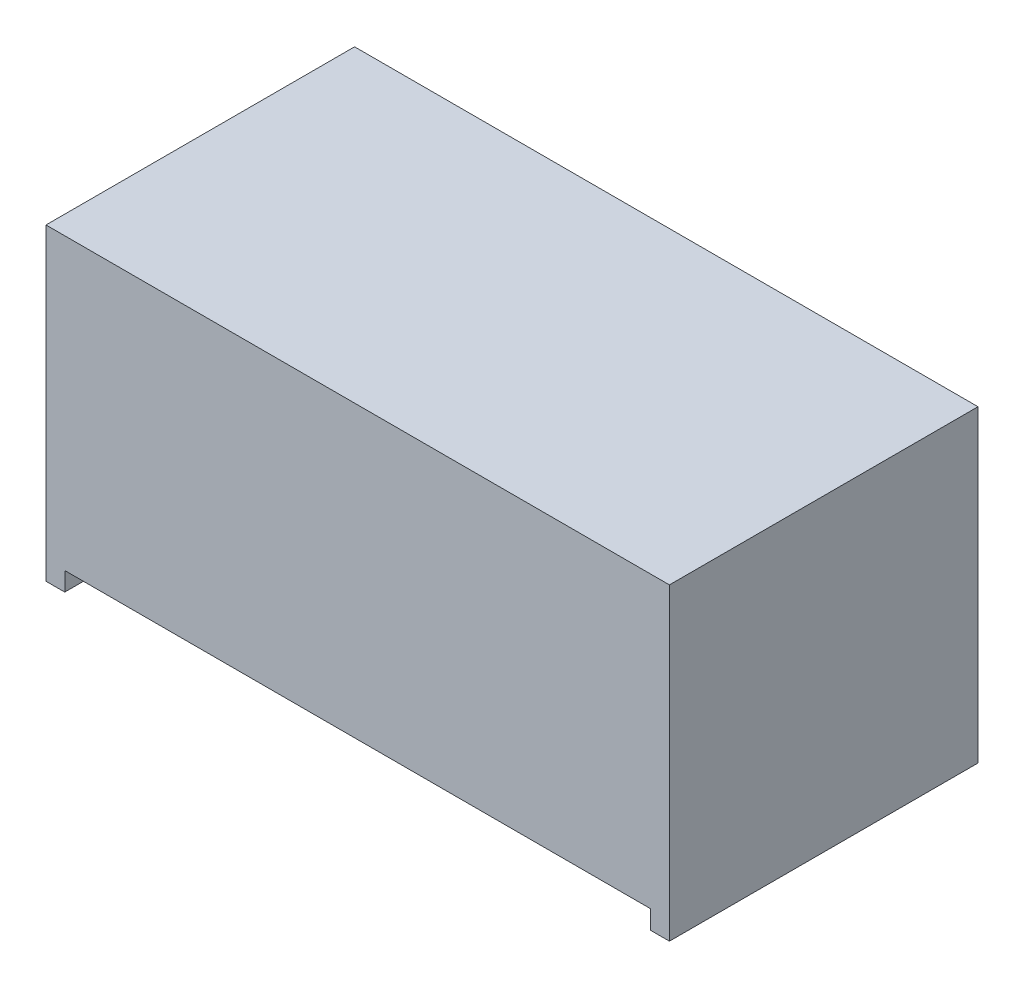
from build123d import *

# Parameters (mm, degrees)
SKETCH1_W           = 20
SKETCH1_H           = 9.9
BOSS_EXTRUDE1_DEPTH = 9.3
SKETCH2_W           = 0.601689641
SKETCH2_H           = 9.9
BOSS_EXTRUDE2_DEPTH = 0.6


with BuildPart() as part:
    # Sketch1 → Boss-Extrude1 (new body)
    with BuildSketch(Plane(origin=(0, 0, 0), x_dir=(1, 0, 0), z_dir=(0, 1, 0))):
        Rectangle(SKETCH1_W, SKETCH1_H)
    extrude(amount=BOSS_EXTRUDE1_DEPTH)

    # Sketch2 → Boss-Extrude2 (add)
    with BuildSketch(Plane.XZ):
        with Locations((-9.699155179, 0)):
            Rectangle(SKETCH2_W, SKETCH2_H)
        with Locations((9.699155179, 0)):
            Rectangle(SKETCH2_W, SKETCH2_H)
    extrude(amount=BOSS_EXTRUDE2_DEPTH)


solid = part.part
